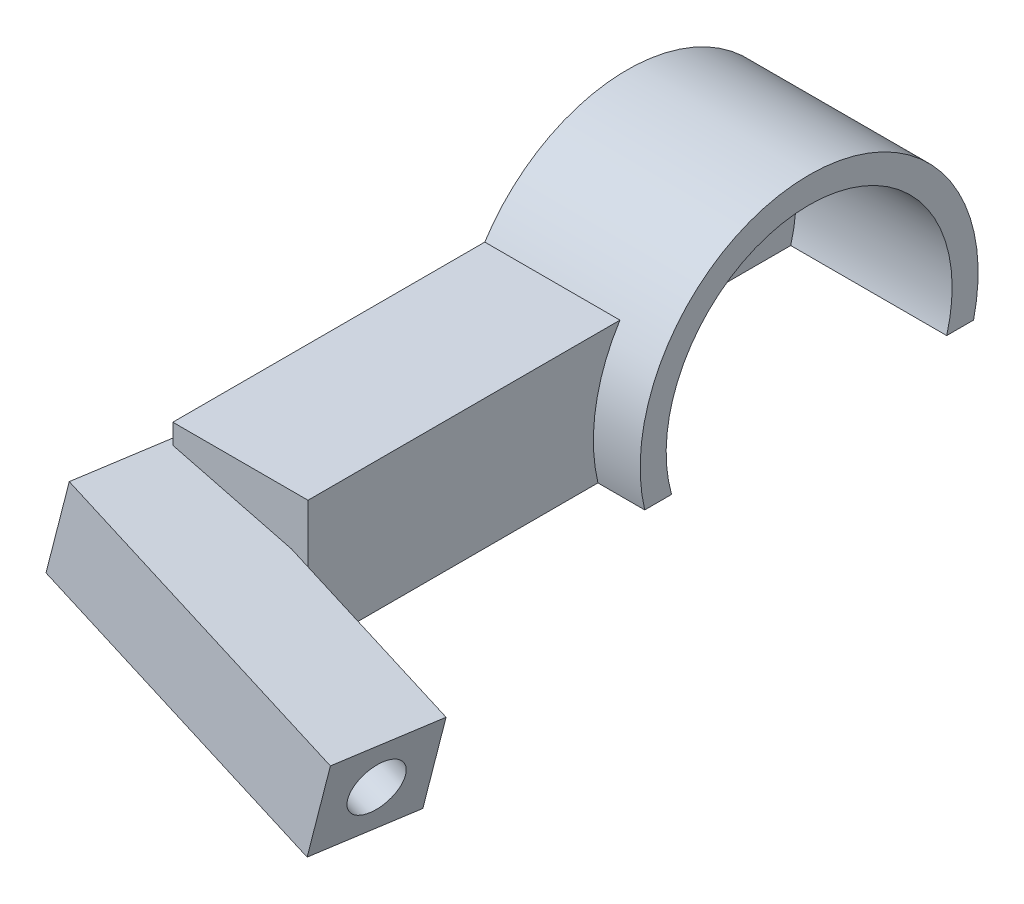
from build123d import *

# Parameters (mm, degrees)
EXTRUDE_1_DEPTH      = 35
SKETCH_6_W           = 60
SKETCH_6_H           = 25
EXTRUDE_2_DEPTH      = 26
SKETCH_4_R           = 27.5
CUT_EXTRUDE_1_DEPTH  = 30
EXTRUDE_3_DEPTH      = 22
EXTRUDE_3_DEPTH_BACK = 38
SKETCH_12_W          = 20
SKETCH_12_H          = 18
SKETCH_12_R          = 5


with BuildPart() as part:
    # 草图2 → 凸台-拉伸1 (new body)
    with BuildSketch(Plane(origin=(0, 0, 0), x_dir=(0, 0, -1), z_dir=(1, 0, 0))):
        with BuildLine():
            Line((-31.622776602, -7.5), (31.622776602, -7.5))
            ThreePointArc((31.622776602, -7.5), (0, 32.5), (-31.622776602, -7.5))
        make_face()
    extrude(amount=EXTRUDE_1_DEPTH)

    # 草图6 → 凸台-拉伸2 (add)
    with BuildSketch(Plane.ZY):
        with Locations((57.386127875, 5)):
            Rectangle(SKETCH_6_W, SKETCH_6_H)
    extrude(amount=-EXTRUDE_2_DEPTH)

    # 草图4 → 切除-拉伸1 (cut)
    with BuildSketch(Plane(origin=(35, 0, 0), x_dir=(0, 0, -1), z_dir=(1, 0, 0))):
        Circle(SKETCH_4_R)
    extrude(amount=-CUT_EXTRUDE_1_DEPTH, mode=Mode.SUBTRACT)

    # 草图12 → 凸台-拉伸3 (add, two sides: drawn at the far end of the back side and taken through both)
    with BuildSketch(Plane(origin=(17, 0, 97), x_dir=(-0.12015591727422713, 0.0308332759507369, 0.9922761030268414), z_dir=(-0.9611356730519813, 0.246637553152495, -0.12404892325959627)).offset(-EXTRUDE_3_DEPTH_BACK)):
        Rectangle(SKETCH_12_W, SKETCH_12_H)
        Circle(SKETCH_12_R, mode=Mode.SUBTRACT)
    extrude(amount=EXTRUDE_3_DEPTH + EXTRUDE_3_DEPTH_BACK)


solid = part.part
